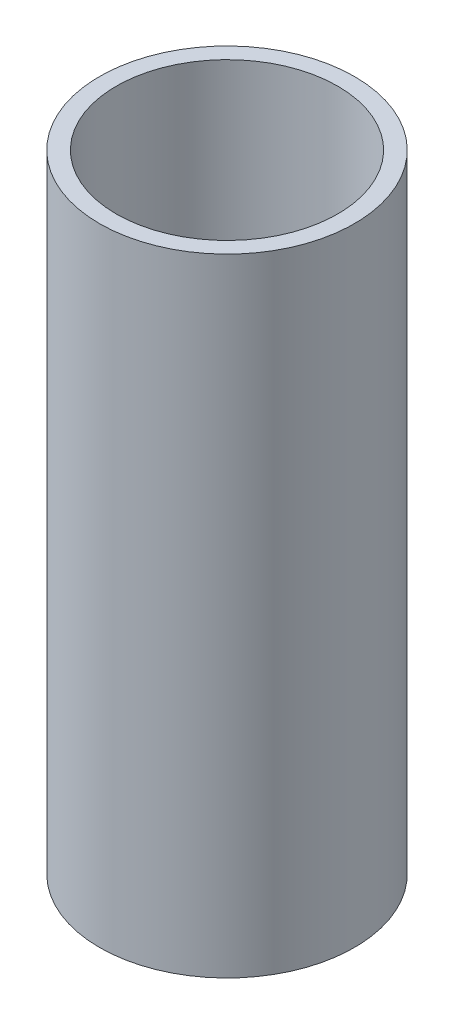
from build123d import *

# Parameters (mm, degrees)
SKETCH1_R           = 30.5
SKETCH1_R_2         = 26.5
BOSS_EXTRUDE1_DEPTH = 150


with BuildPart() as part:
    # Sketch1 → Boss-Extrude1 (new body)
    with BuildSketch(Plane(origin=(0, 0, 0), x_dir=(1, 0, 0), z_dir=(0, 1, 0))):
        with Locations(Location((0, 0, 0), (0, 0, 270))):
            Circle(SKETCH1_R)
        with Locations(Location((0, 0, 0), (0, 0, 270))):
            Circle(SKETCH1_R_2, mode=Mode.SUBTRACT)
    extrude(amount=BOSS_EXTRUDE1_DEPTH)


solid = part.part
